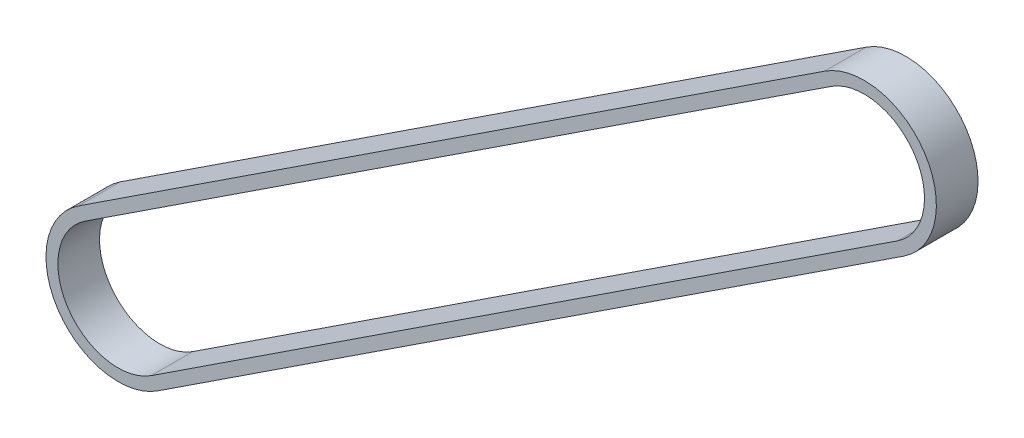
from build123d import *

# Parameters (mm, degrees)
EXTRUDE_1_DEPTH = 3.5


with BuildPart() as part:
    # 草图2 → 拉伸-薄壁1 (new, symmetric)
    with BuildSketch(Plane.XY):
        with BuildLine():
            Line((180.241397001, 38.928398846), (54.842053695, -43.382017861))
            ThreePointArc((54.842053695, -43.382017861), (38.052181428, -39.898996294), (41.535202994, -23.109124026))
            Line((41.535202994, -23.109124026), (166.9345463, 59.201292681))
            ThreePointArc((166.9345463, 59.201292681), (183.724418568, 55.718271114), (180.241397001, 38.928398846))
        make_face()
        with BuildLine():
            Line((179.143924778, 40.60039009), (53.744581473, -41.710026617))
            ThreePointArc((53.744581473, -41.710026617), (39.724172672, -38.801524071), (42.632675217, -24.78111527))
            Line((42.632675217, -24.78111527), (168.032018523, 57.529301437))
            ThreePointArc((168.032018523, 57.529301437), (182.052427324, 54.620798891), (179.143924778, 40.60039009))
        make_face(mode=Mode.SUBTRACT)
    extrude(amount=EXTRUDE_1_DEPTH, both=True)


solid = part.part
